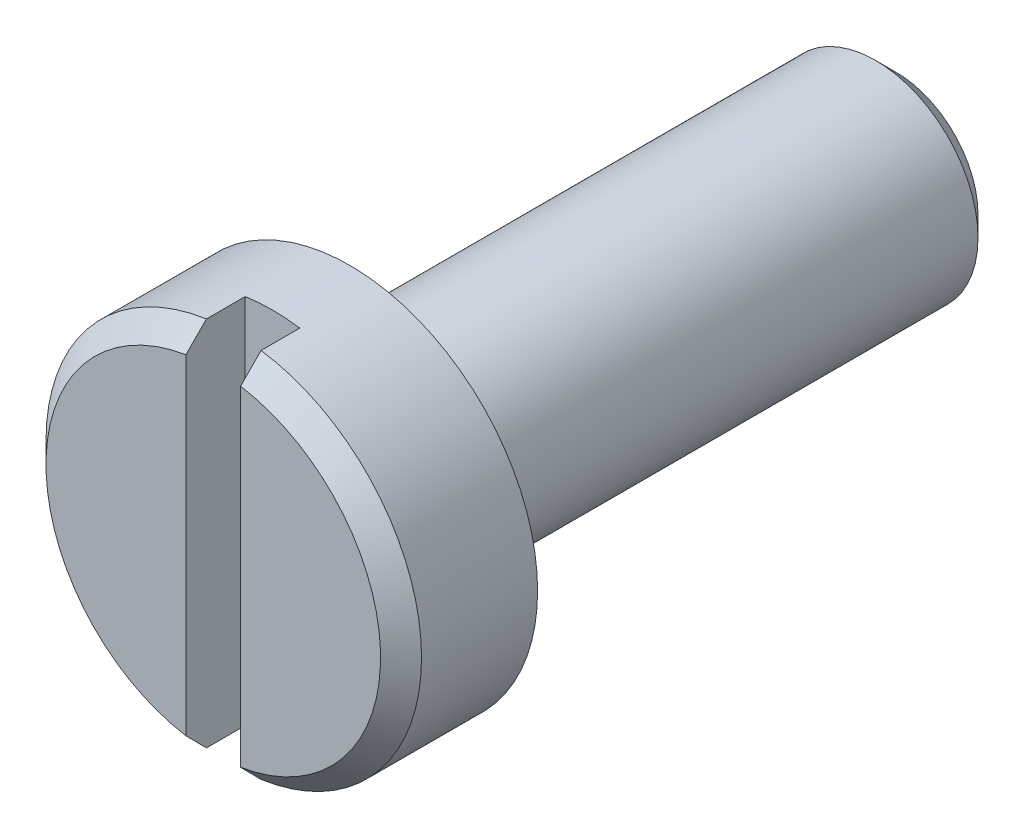
from build123d import *

# Parameters (mm, degrees)
SKETCH1_R               = 1.5
BOSS_EXTRUDE1_DEPTH     = 8
SKETCH2_R               = 2.75
BOSS_EXTRUDE2_DEPTH     = 2
CHAMFER1_SIZE           = 0.3
CUT_EXTRUDE1_DEPTH      = 9.895223437
CUT_EXTRUDE1_DEPTH_BACK = 9.895223437
SKETCH3_W               = 0.8
SKETCH3_H               = 1.7


with BuildPart() as part:
    # Sketch1 → Boss-Extrude1 (new body)
    with BuildSketch(Plane.XY):
        Circle(SKETCH1_R)
    extrude(amount=-BOSS_EXTRUDE1_DEPTH)

    # Sketch2 → Boss-Extrude2 (add)
    with BuildSketch(Plane.XY):
        Circle(SKETCH2_R)
    extrude(amount=BOSS_EXTRUDE2_DEPTH)

    # Chamfer1
    chamfer1_edges = [part.edges().sort_by_distance(p)[0] for p in [
        (-1.5, 0, -8),
        (-2.75, 0, 2),
    ]]
    chamfer(chamfer1_edges, length=CHAMFER1_SIZE)

    # Sketch3 → Cut-Extrude1 (cut, two sides: drawn at the far end of the back side and taken through both)
    with BuildSketch(Plane(origin=(0, 0, 0), x_dir=(1, 0, 0), z_dir=(0, 1, 0)).offset(-CUT_EXTRUDE1_DEPTH_BACK)):
        with Locations((0, -1.982738086)):
            Rectangle(SKETCH3_W, SKETCH3_H)
    extrude(amount=CUT_EXTRUDE1_DEPTH + CUT_EXTRUDE1_DEPTH_BACK, mode=Mode.SUBTRACT)


solid = part.part
